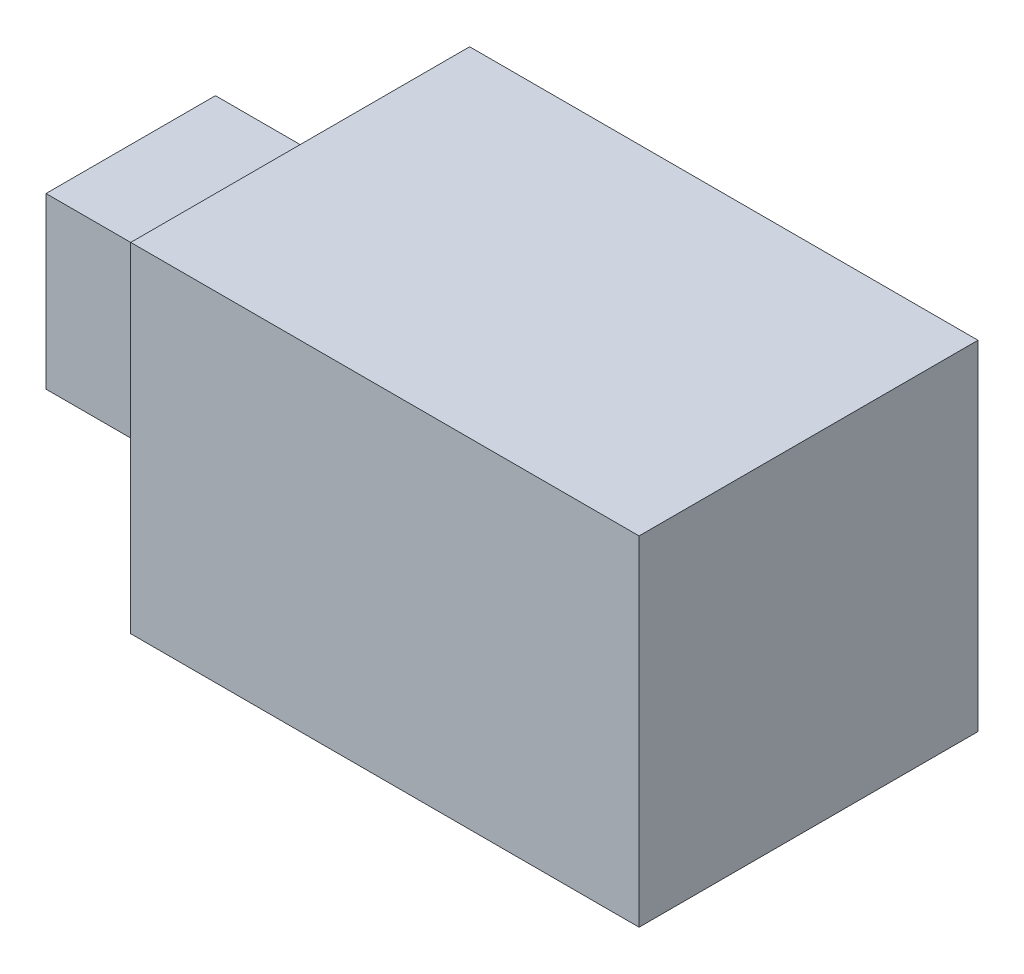
from build123d import *

# Parameters (mm, degrees)
SKETCH2_W           = 12.7
SKETCH2_H           = 12.7
BOSS_EXTRUDE1_DEPTH = 12.7
SKETCH3_W           = 25.4
SKETCH3_H           = 25.4
BOSS_EXTRUDE2_DEPTH = 38.1


with BuildPart() as part:
    # Sketch2 → Boss-Extrude1 (new body)
    with BuildSketch(Plane(origin=(0, 0, 0), x_dir=(0, 0, -1), z_dir=(1, 0, 0))):
        Rectangle(SKETCH2_W, SKETCH2_H)
    extrude(amount=BOSS_EXTRUDE1_DEPTH)

    # Sketch3 → Boss-Extrude2 (add)
    with BuildSketch(Plane(origin=(12.7, 0, 0), x_dir=(0, 0, -1), z_dir=(1, 0, 0))):
        Rectangle(SKETCH3_W, SKETCH3_H)
    extrude(amount=BOSS_EXTRUDE2_DEPTH)


solid = part.part
